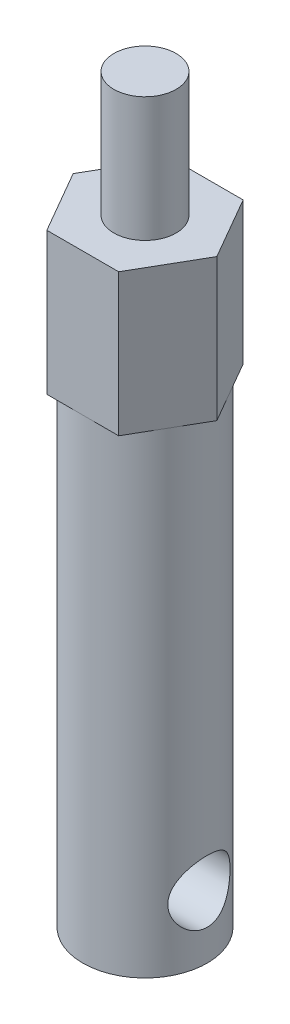
from build123d import *

# Parameters (mm, degrees)
SKETCH1_R               = 6.35
BOSS_EXTRUDE1_DEPTH     = 48.44415
BOSS_EXTRUDE2_DEPTH     = 14.499999936
CUT_EXTRUDE1_DEPTH      = 64.687140339
CUT_EXTRUDE1_DEPTH_BACK = 64.687140339
SKETCH4_R               = 3.175
SKETCH5_R               = 3.175
BOSS_EXTRUDE3_DEPTH     = 12.7


with BuildPart() as part:
    # Sketch1 → Boss-Extrude1 (new body)
    with BuildSketch(Plane(origin=(0, 0, 0), x_dir=(1, 0, 0), z_dir=(0, 1, 0))):
        with Locations(Location((0, 0, 0), (0, 0, 270))):
            Circle(SKETCH1_R)
    extrude(amount=BOSS_EXTRUDE1_DEPTH)

    # Sketch2 → Boss-Extrude2 (add)
    with BuildSketch(Plane(origin=(0, 48.44415, 0), x_dir=(1, 0, 0), z_dir=(0, 1, 0))):
        Polygon((7.332348419, 0), (3.666174209, 6.35), (-3.666174209, 6.35), (-7.332348419, 0), (-3.666174209, -6.35), (3.666174209, -6.35), align=None)
    extrude(amount=BOSS_EXTRUDE2_DEPTH)

    # Sketch4 → Cut-Extrude1 (cut, two sides: drawn at the far end of the back side and taken through both)
    with BuildSketch(Plane(origin=(0, 0, 0), x_dir=(0, 0, -1), z_dir=(1, 0, 0)).offset(-CUT_EXTRUDE1_DEPTH_BACK)):
        with Locations((0, 6.35)):
            Circle(SKETCH4_R)
    extrude(amount=CUT_EXTRUDE1_DEPTH + CUT_EXTRUDE1_DEPTH_BACK, mode=Mode.SUBTRACT)

    # Sketch5 → Boss-Extrude3 (add)
    with BuildSketch(Plane(origin=(0, 62.944149936, 0), x_dir=(1, 0, 0), z_dir=(0, 1, 0))):
        with Locations(Location((0, 0, 0), (0, 0, 270))):
            Circle(SKETCH5_R)
    extrude(amount=BOSS_EXTRUDE3_DEPTH)


solid = part.part
